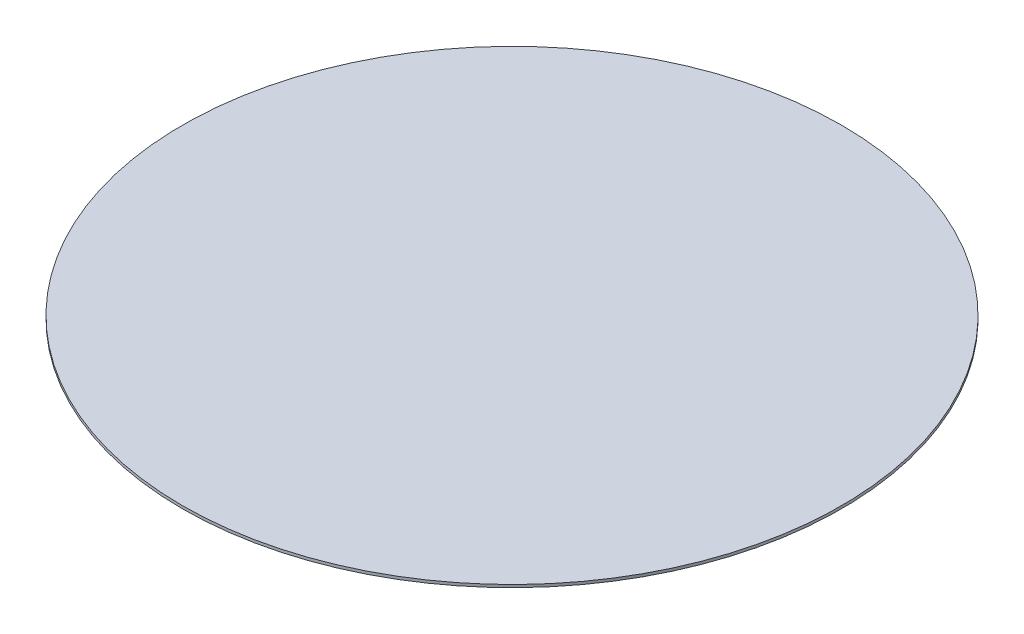
from build123d import *

# Parameters (mm, degrees)
SKETCH1_R           = 95.25
BOSS_EXTRUDE1_DEPTH = 0.79375


with BuildPart() as part:
    # Sketch1 → Boss-Extrude1 (new body)
    with BuildSketch(Plane(origin=(0, 0, 0), x_dir=(1, 0, 0), z_dir=(0, 1, 0))):
        with Locations(Location((0, 0, 0), (0, 0, 270))):
            Circle(SKETCH1_R)
    extrude(amount=BOSS_EXTRUDE1_DEPTH)


solid = part.part
